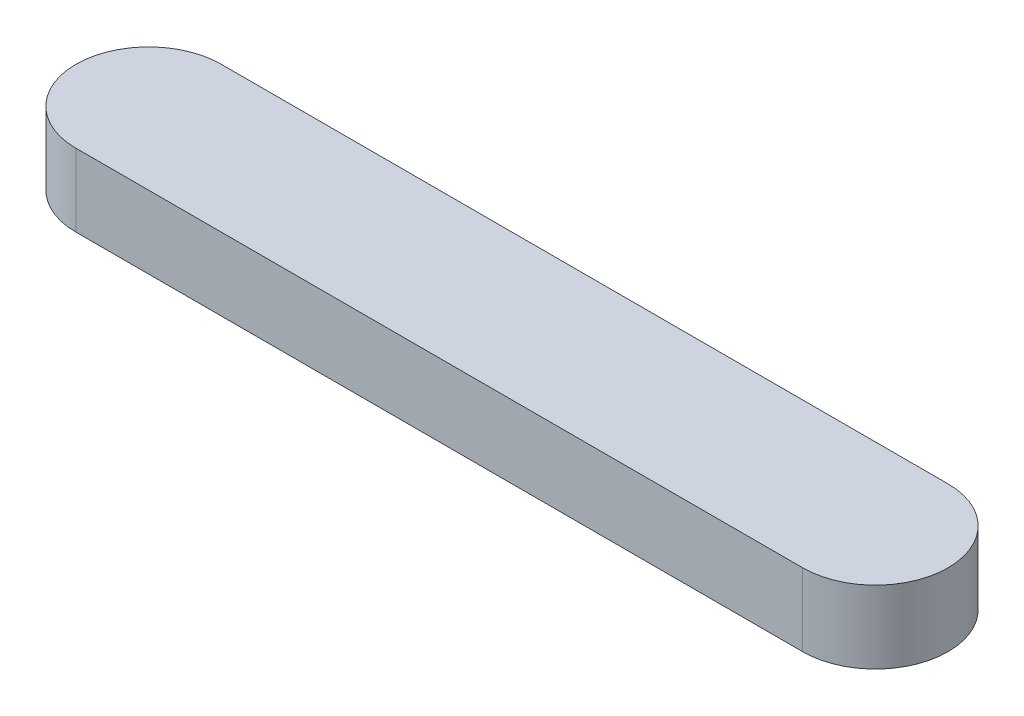
from build123d import *

# Parameters (mm, degrees)
BOSS_EXTRUDE1_DEPTH = 2.54


with BuildPart() as part:
    # Sketch1 → Boss-Extrude1 (new body)
    with BuildSketch(Plane(origin=(0, 0, 0), x_dir=(1, 0, 0), z_dir=(0, 1, 0))):
        with BuildLine():
            Line((0, 2.54), (25.4, 2.54))
            ThreePointArc((25.4, 2.54), (27.94, 0), (25.4, -2.54))
            Line((25.4, -2.54), (0, -2.54))
            ThreePointArc((0, -2.54), (-2.54, 0), (0, 2.54))
        make_face()
    extrude(amount=BOSS_EXTRUDE1_DEPTH)


solid = part.part
